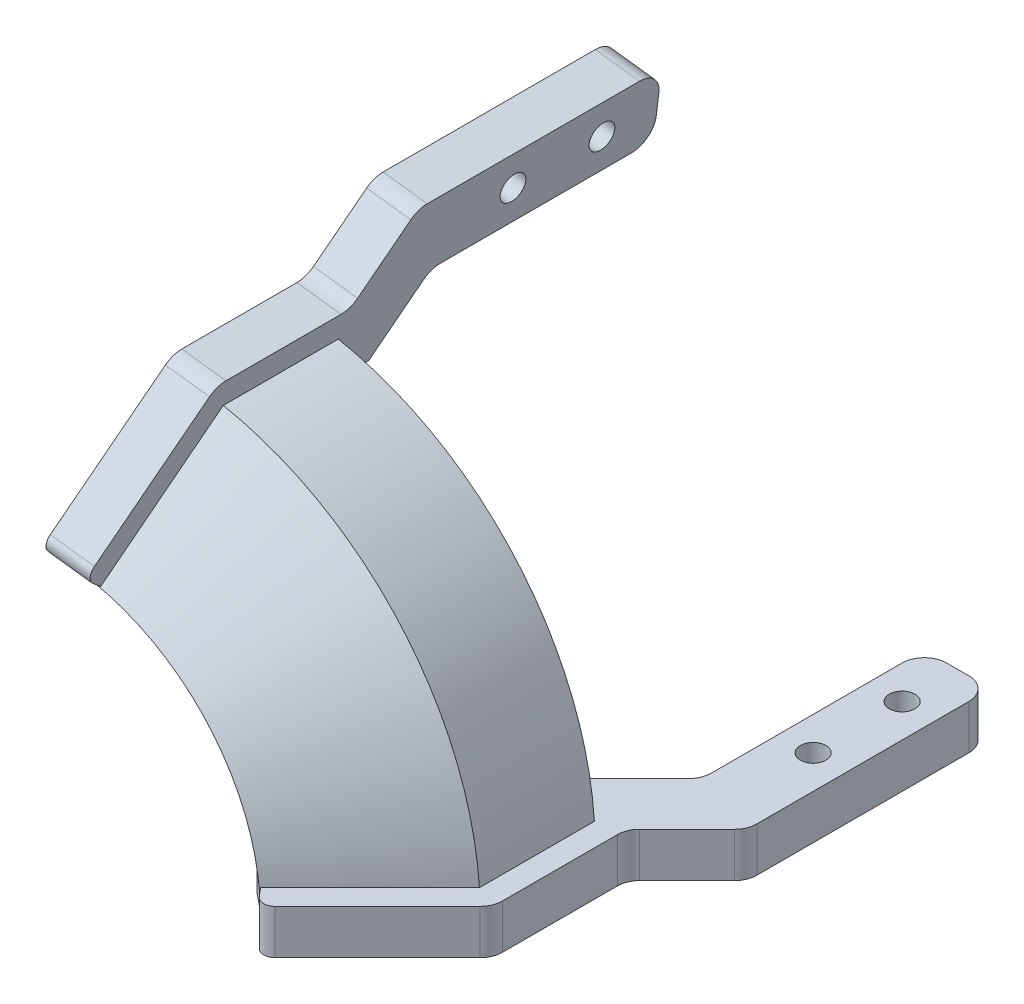
from build123d import *

# Parameters (mm, degrees)
SKETCH_1_R                       = 1.15
EXTRUDE_1_DEPTH                  = 4
FILLET_1_R                       = 2
FILLET_2_R                       = 1
REVOLVE_2_ANGLE                  = 83
PATTERN_CIRCULAR_4_COUNT         = 2
PATTERN_CIRCULAR_4_ANGLE         = 83
FILLET_1_OF_PATTERN_CIRCULAR_4_R = 2
FILLET_2_OF_PATTERN_CIRCULAR_4_R = 1


with BuildPart() as part:
    # 草图1 → 凸台-拉伸1 (new body)
    with BuildSketch(Plane(origin=(0, 0, 0), x_dir=(1, 0, 0), z_dir=(0, 1, 0))):
        with BuildLine():
            Line((15, 20), (25, 30))
            Line((25, 30), (25, 40))
            Line((25, 40), (30, 45))
            Line((30, 45), (30, 65))
            Line((30, 65), (36, 65))
            Line((36, 65), (36, 43.100505063))
            Line((36, 43.100505063), (30.563454525, 37.663959588))
            Line((30.563454525, 37.663959588), (30.563454525, 25.663959588))
            Line((30.563454525, 25.663959588), (19.956852807, 15.05735787))
            ThreePointArc((19.956852807, 15.05735787), (17.652275132, 17.7030275), (15, 20))
        make_face()
        with Locations(Location((33, 60, 0), (0, 0, 270))):
            Circle(SKETCH_1_R, mode=Mode.SUBTRACT)
        with Locations(Location((33, 52, 0), (0, 0, 270))):
            Circle(SKETCH_1_R, mode=Mode.SUBTRACT)
    extrude_1 = extrude(amount=EXTRUDE_1_DEPTH)

    # 圆角1
    fillet_1_edges = [part.edges().sort_by_distance(p)[0] for p in [
        (30, 2, -45),
        (30, 2, -65),
        (36, 2, -65),
        (36, 2, -43.100505063),
        (30.563454525, 2, -37.663959588),
        (30.563454525, 2, -25.663959588),
    ]]
    fillet(fillet_1_edges, radius=FILLET_1_R)

    # 圆角2
    fillet_2_edges = [part.edges().sort_by_distance(p)[0] for p in [
        (19.956852807, 2, -15.05735787),
    ]]
    fillet(fillet_2_edges, radius=FILLET_2_R)

    # 草图2 → 旋转2 (revolve)
    with BuildSketch(Plane(origin=(0, 2, 0), x_dir=(1, 0, 0), z_dir=(0, 1, 0))):
        with BuildLine():
            Line((28.563454525, 26.492386713), (28.563454525, 36.835532463))
            Line((28.563454525, 36.835532463), (25, 36.835532463))
            Line((25, 36.835532463), (25, 30))
            Line((25, 30), (15, 20))
            ThreePointArc((15, 20), (16.926416038, 18.398272748), (18.682847286, 16.611779474))
            Line((18.682847286, 16.611779474), (28.563454525, 26.492386713))
        make_face()
    revolve(axis=Axis((0, 2, -67.472032035), (0, 0, 1)), revolution_arc=REVOLVE_2_ANGLE)

    # 阵列(圆周)4: 凸台-拉伸1 ×2 about axis
    pattern_circular_4_axis = Axis((0, 2, 0), (0, 0, 1))
    for i in range(1, PATTERN_CIRCULAR_4_COUNT):
        add(extrude_1.rotate(pattern_circular_4_axis, i * PATTERN_CIRCULAR_4_ANGLE / (PATTERN_CIRCULAR_4_COUNT - 1)))

    # 圆角1 of 阵列(圆周)4
    fillet_1_of_pattern_circular_4_edges = [part.edges().sort_by_distance(p)[0] for p in [
        (3.656080302, 31.776384549, -45),
        (3.656080302, 31.776384549, -65),
        (4.387296363, 37.731661459, -65),
        (4.387296363, 37.731661459, -43.100505063),
        (3.724748135, 32.335639169, -37.663959588),
        (3.724748135, 32.335639169, -25.663959588),
    ]]
    fillet(fillet_1_of_pattern_circular_4_edges, radius=FILLET_1_OF_PATTERN_CIRCULAR_4_R)

    # 圆角2 of 阵列(圆周)4
    fillet_2_of_pattern_circular_4_edges = [part.edges().sort_by_distance(p)[0] for p in [
        (2.432128548, 21.808097452, -15.05735787),
    ]]
    fillet(fillet_2_of_pattern_circular_4_edges, radius=FILLET_2_OF_PATTERN_CIRCULAR_4_R)


solid = part.part
